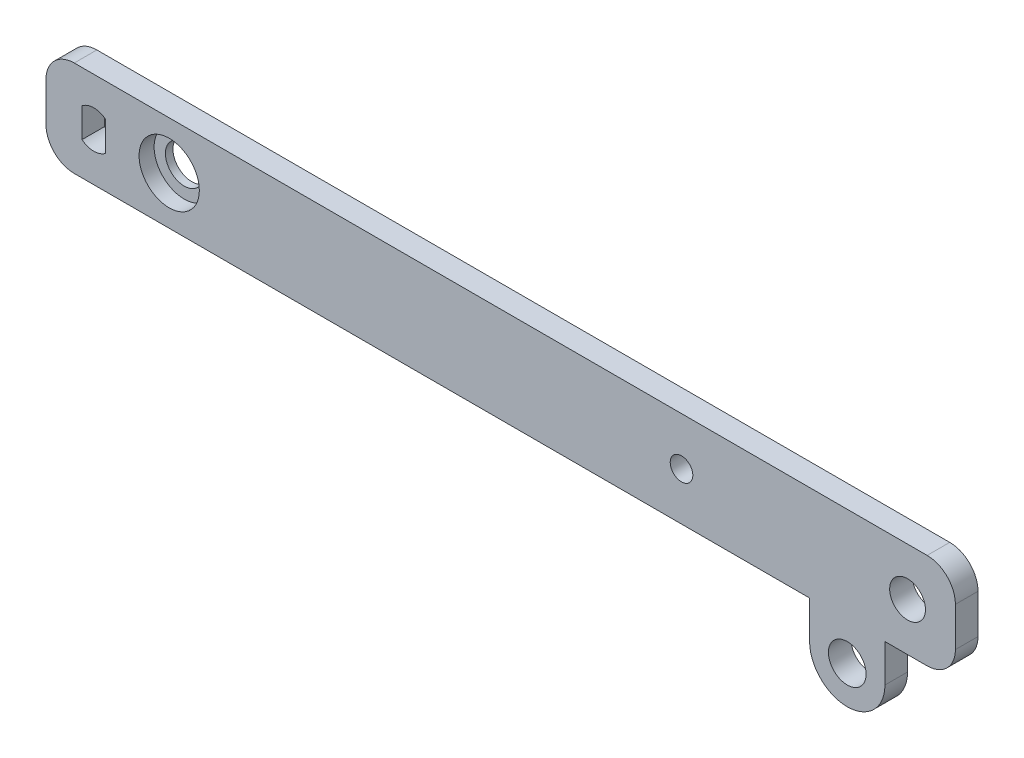
from build123d import *

# Parameters (mm, degrees)
CROQUIS1_R              = 9.5
CROQUIS1_R_2            = 10
CROQUIS1_R_3            = 6
SALIENTE_EXTRUIR1_DEPTH = 12
CROQUIS2_R              = 2.144956207
CORTAR_EXTRUIR1_DEPTH   = 3
REDONDEO1_R             = 15
REDONDEO2_R             = 15
CROQUIS4_R              = 16
CORTAR_EXTRUIR2_DEPTH   = 8


with BuildPart() as part:
    # Croquis1 → Saliente-Extruir1 (new body)
    with BuildSketch(Plane.XY):
        with BuildLine():
            Line((380, -45.4), (380, -25.4))
            Line((380, -25.4), (-25.4, -25.4))
            Line((-25.4, -25.4), (-25.4, 25.4))
            Line((-25.4, 25.4), (457.4, 25.4))
            Line((457.4, 25.4), (457.4, -25.4))
            Line((457.4, -25.4), (420, -25.4))
            Line((420, -25.4), (420, -45.4))
            ThreePointArc((420, -45.4), (400, -65.4), (380, -45.4))
        make_face()
        with Locations((432, 0)):
            Circle(CROQUIS1_R, mode=Mode.SUBTRACT)
        with Locations((40, 0)):
            Circle(CROQUIS1_R_2, mode=Mode.SUBTRACT)
        with Locations((312, 0)):
            Circle(CROQUIS1_R_3, mode=Mode.SUBTRACT)
        with Locations((400, -45.4)):
            Circle(CROQUIS1_R_2, mode=Mode.SUBTRACT)
        with BuildLine():
            Line((-6.28, -7.782133384), (-6.28, 7.782133384))
            ThreePointArc((-6.28, 7.782133384), (0, 10), (6.28, 7.782133384))
            Line((6.28, 7.782133384), (6.28, -7.782133384))
            ThreePointArc((6.28, -7.782133384), (0, -10), (-6.28, -7.782133384))
        make_face(mode=Mode.SUBTRACT)
    extrude(amount=SALIENTE_EXTRUIR1_DEPTH)

    # Croquis2 → Cortar-Extruir1 (cut)
    with BuildSketch(Plane(origin=(0, 0, 0), x_dir=(-1, 0, 0), z_dir=(0, 0, -1))):
        with Locations((-66.437001332, -11.298220954)):
            Circle(CROQUIS2_R)
    extrude(amount=-CORTAR_EXTRUIR1_DEPTH, mode=Mode.SUBTRACT)

    # Redondeo1
    redondeo1_edges = [part.edges().sort_by_distance(p)[0] for p in [
        (-25.4, 25.4, 6),
        (-25.4, -25.4, 6),
    ]]
    fillet(redondeo1_edges, radius=REDONDEO1_R)

    # Redondeo2
    redondeo2_edges = [part.edges().sort_by_distance(p)[0] for p in [
        (457.4, 25.4, 6),
        (457.4, -25.4, 6),
    ]]
    fillet(redondeo2_edges, radius=REDONDEO2_R)

    # Croquis4 → Cortar-Extruir2 (cut)
    with BuildSketch(Plane.XY.offset(12)):
        with Locations((40, 0)):
            Circle(CROQUIS4_R)
    extrude(amount=-CORTAR_EXTRUIR2_DEPTH, mode=Mode.SUBTRACT)


solid = part.part
